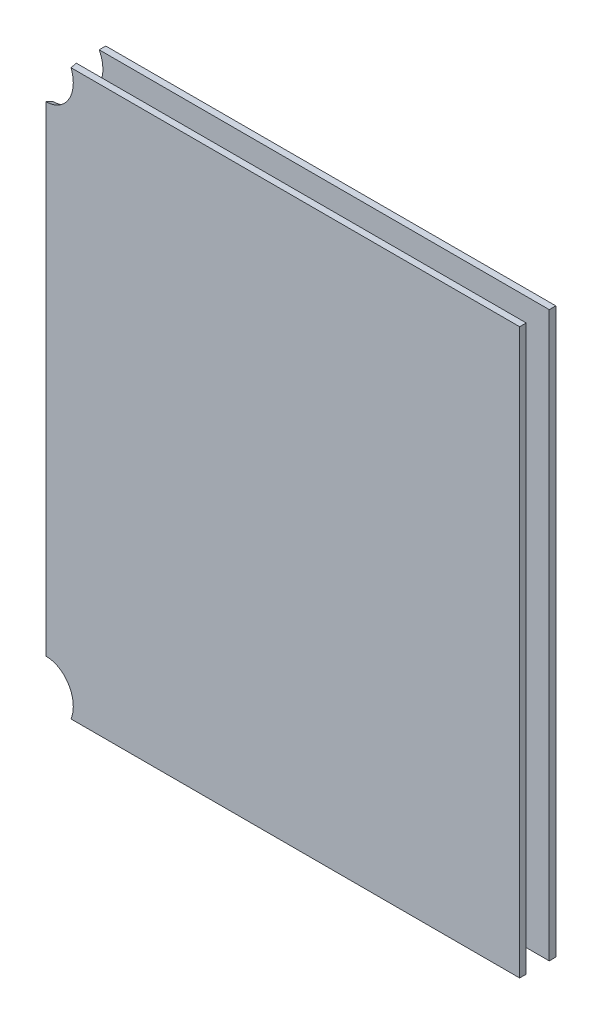
from build123d import *

# Parameters (mm, degrees)
SKETCH2_W           = 228.6
SKETCH2_H           = 272.333207428
BOSS_EXTRUDE2_DEPTH = 1.5875
SKETCH4_R           = 13.081
CUT_EXTRUDE2_DEPTH  = 356.900789089
BOSS_EXTRUDE3_DEPTH = 3.175


with BuildPart() as part:
    # Sketch2 → Boss-Extrude2 (new, symmetric)
    with BuildSketch(Plane.XY):
        with Locations((1020.6228, 0)):
            Rectangle(SKETCH2_W, SKETCH2_H)
    extrude(amount=BOSS_EXTRUDE2_DEPTH, both=True)

    # Sketch4 → Cut-Extrude2 (cut, through all)
    with BuildSketch(Plane(origin=(906.3228, 136.166603714, 13.97), x_dir=(-1, 0, 0), z_dir=(-8.741913579725579e-15, -0.4228367232518726, -0.9062058847025986))):
        Circle(SKETCH4_R)
    cut_extrude2 = extrude(amount=CUT_EXTRUDE2_DEPTH, mode=Mode.SUBTRACT)

    # Mirror2: Cut-Extrude2 across plane
    add(cut_extrude2.mirror(Plane.ZX), mode=Mode.SUBTRACT)


with BuildPart() as body_2:
    # Sketch5 → Boss-Extrude3 (new body)
    with BuildSketch(Plane.XY.offset(-12.7)):
        with BuildLine():
            Line((906.3228, 114.472546487), (906.3228, -114.472546487))
            add(Edge.make_bspline(
                [(917.629380504, -136.166603714), (929.067348802, -114.472546487), (906.3228, -114.472546487)],
                knots=[1.043859165, 1.043859165, 1.043859165, 3.141592654, 3.141592654, 3.141592654], degree=2, weights=[1, 0.49855374, 1]))
            Line((917.629380504, -136.166603714), (1134.9228, -136.166603714))
            Line((1134.9228, -136.166603714), (1134.9228, 136.166603714))
            Line((1134.9228, 136.166603714), (917.629380504, 136.166603714))
            add(Edge.make_bspline(
                [(906.3228, 114.472546487), (929.067348802, 114.472546487), (917.629380504, 136.166603714)],
                knots=[3.141592654, 3.141592654, 3.141592654, 5.239326142, 5.239326142, 5.239326142], degree=2, weights=[1, 0.49855374, 1]))
        make_face()
    extrude(amount=-BOSS_EXTRUDE3_DEPTH)


solid = Compound([part.part, body_2.part])
